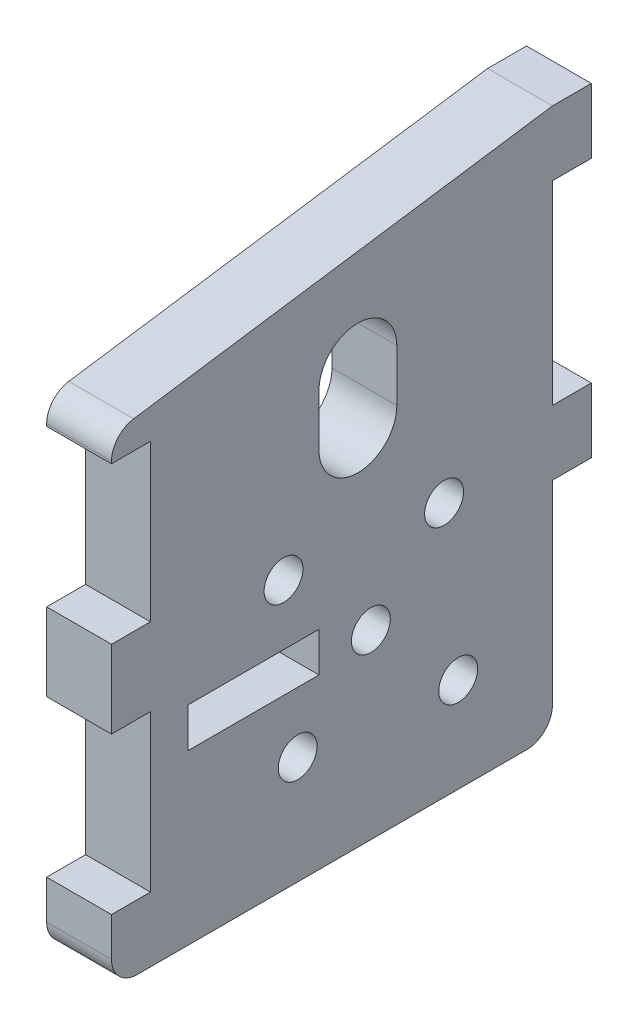
from build123d import *

# Parameters (mm, degrees)
SKETCH1_R           = 1.5
BOSS_EXTRUDE1_DEPTH = 5
SKETCH2_W           = 3
SKETCH2_H           = 12.05
SKETCH2_W_2         = 10.1
SKETCH2_H_2         = 3.05
CUT_EXTRUDE1_DEPTH  = 35.770677301
CUT_EXTRUDE3_DEPTH  = 10
FILLET1_R           = 2


with BuildPart() as part:
    # Sketch1 → Boss-Extrude1 (new body)
    with BuildSketch(Plane(origin=(0, 0, 0), x_dir=(0, 0, -1), z_dir=(1, 0, 0))):
        Polygon((17, 28), (17, 23), (14, 23), (14, 8), (17, 8), (17, 3), (14, 3), (14, -14), (-20, -14), (-20, 23), (14, 28), align=None)
        with Locations((-6.733876165, 6.701112728)):
            Circle(SKETCH1_R, mode=Mode.SUBTRACT)
        with Locations((-5.643042298, -5.67063256)):
            Circle(SKETCH1_R, mode=Mode.SUBTRACT)
        with Locations((6.733876165, -6.701112728)):
            Circle(SKETCH1_R, mode=Mode.SUBTRACT)
        with Locations((5.643042298, 5.67063256)):
            Circle(SKETCH1_R, mode=Mode.SUBTRACT)
        Circle(SKETCH1_R, mode=Mode.SUBTRACT)
    extrude(amount=BOSS_EXTRUDE1_DEPTH)

    # Sketch2 → Cut-Extrude1 (cut, through all)
    with BuildSketch(Plane(origin=(5, 0, 0), x_dir=(0, 0, -1), z_dir=(1, 0, 0))):
        with Locations((-18.5, 15.075)):
            Rectangle(SKETCH2_W, SKETCH2_H)
        with Locations((-9.05, 0.525)):
            Rectangle(SKETCH2_W_2, SKETCH2_H_2)
        with Locations((-18.5, -2.975)):
            Rectangle(SKETCH2_W, SKETCH2_H)
    extrude(amount=-CUT_EXTRUDE1_DEPTH, mode=Mode.SUBTRACT)

    # Sketch4 → Cut-Extrude3 (cut)
    with BuildSketch(Plane(origin=(5, 0, 0), x_dir=(0, 0, -1), z_dir=(1, 0, 0))):
        with BuildLine():
            Line((-4, 18), (-4, 14))
            ThreePointArc((-4, 14), (-1, 11), (2, 14))
            Line((2, 14), (2, 18))
            ThreePointArc((2, 18), (-1, 21), (-4, 18))
        make_face()
    extrude(amount=-CUT_EXTRUDE3_DEPTH, mode=Mode.SUBTRACT)

    # Fillet1
    fillet1_edges = [part.edges().sort_by_distance(p)[0] for p in [
        (2.5, -14, -14),
        (2.5, -14, 20),
        (2.5, 23, 20),
    ]]
    fillet(fillet1_edges, radius=FILLET1_R)


solid = part.part
